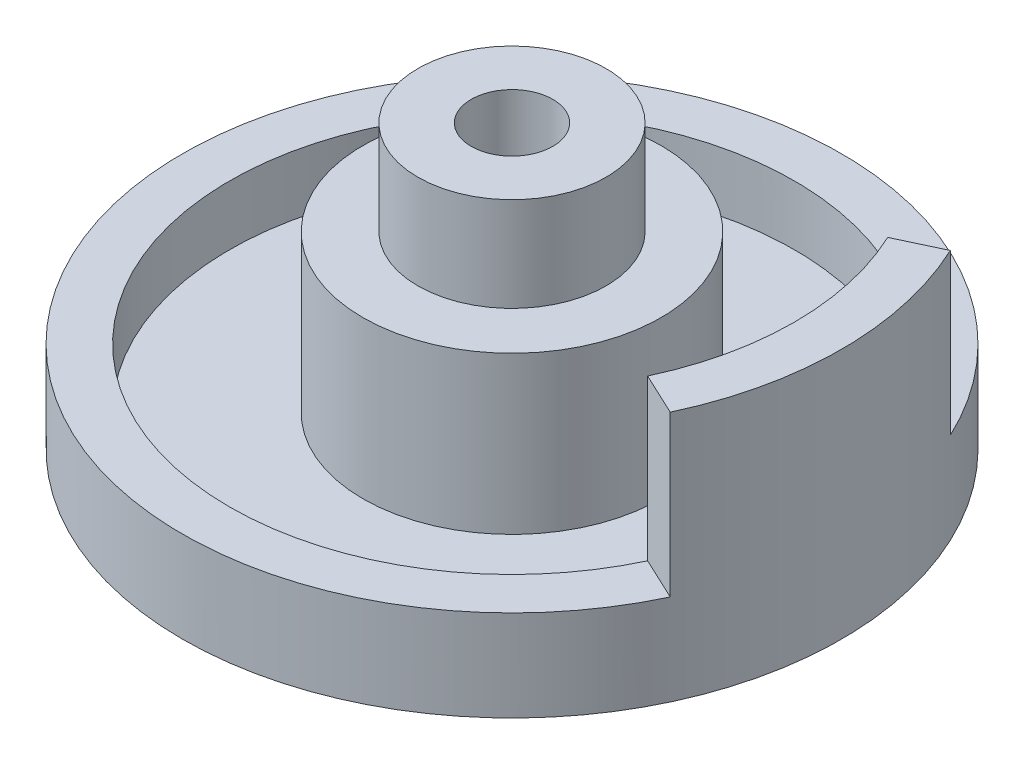
from build123d import *

# Parameters (mm, degrees)
SCHIZZO2_R                   = 10.5
ESTRUSIONE_ESTRUSIONE1_DEPTH = 8
TAGLIO_ESTRUSIONE1_START     = -2
TAGLIO_ESTRUSIONE1_DEPTH     = 2
TAGLIO_ESTRUSIONE2_START     = -3.1
SCHIZZO4_R                   = 4.75
TAGLIO_ESTRUSIONE2_DEPTH     = 3.1
TAGLIO_ESTRUSIONE4_START     = -1.9
SCHIZZO5_R                   = 9
SCHIZZO5_R_2                 = 4.75
TAGLIO_ESTRUSIONE4_DEPTH     = 1.9
SCHIZZO6_R                   = 3
ESTRUSIONE_ESTRUSIONE2_DEPTH = 3
TAGLIO_ESTRUSIONE5_DEPTH     = 2.48
FORO_PER_VITE_M2_1_D         = 2.6


with BuildPart() as part:
    # Schizzo2 → Estrusione-Estrusione1 (new body)
    with BuildSketch(Plane(origin=(0, 0, 0), x_dir=(1, 0, 0), z_dir=(0, 1, 0))):
        with Locations(Location((0, 0, 0), (0, 0, 270))):
            Circle(SCHIZZO2_R)
    extrude(amount=ESTRUSIONE_ESTRUSIONE1_DEPTH)

    # Schizzo3 → Taglio-Estrusione1 (cut)
    with BuildSketch(Plane(origin=(0, 8, 0), x_dir=(1, 0, 0), z_dir=(0, 1, 0)).offset(TAGLIO_ESTRUSIONE1_START)):
        with BuildLine():
            Line((8.146740146, 3.825), (9.50453017, 4.4625))
            ThreePointArc((9.50453017, 4.4625), (-10.5, 0), (9.50453017, -4.4625))
            Line((9.50453017, -4.4625), (8.146740146, -3.825))
            ThreePointArc((8.146740146, -3.825), (9, 0), (8.146740146, 3.825))
        make_face()
    extrude(amount=TAGLIO_ESTRUSIONE1_DEPTH, mode=Mode.SUBTRACT)

    # Schizzo4 → Taglio-Estrusione2 (cut)
    with BuildSketch(Plane(origin=(0, 6, 0), x_dir=(1, 0, 0), z_dir=(0, 1, 0)).offset(TAGLIO_ESTRUSIONE2_START)):
        with BuildLine():
            Line((8.146740146, 3.825), (9.50453017, 4.4625))
            ThreePointArc((9.50453017, 4.4625), (-10.5, 0), (9.50453017, -4.4625))
            Line((9.50453017, -4.4625), (8.146740146, -3.825))
            ThreePointArc((8.146740146, -3.825), (9, 0), (8.146740146, 3.825))
        make_face()
        with Locations(Location((0, 0, 0), (0, 0, 270))):
            Circle(SCHIZZO4_R, mode=Mode.SUBTRACT)
    extrude(amount=TAGLIO_ESTRUSIONE2_DEPTH, mode=Mode.SUBTRACT)

    # Schizzo5 → Taglio-Estrusione4 (cut)
    with BuildSketch(Plane(origin=(0, 2.9, 0), x_dir=(1, 0, 0), z_dir=(0, 1, 0)).offset(TAGLIO_ESTRUSIONE4_START)):
        with Locations(Location((0, 0, 0), (0, 0, 270))):
            Circle(SCHIZZO5_R)
        with Locations(Location((0, 0, 0), (0, 0, 270))):
            Circle(SCHIZZO5_R_2, mode=Mode.SUBTRACT)
    extrude(amount=TAGLIO_ESTRUSIONE4_DEPTH, mode=Mode.SUBTRACT)

    # Schizzo6 → Estrusione-Estrusione2 (add)
    with BuildSketch(Plane(origin=(0, 6, 0), x_dir=(1, 0, 0), z_dir=(0, 1, 0))):
        with Locations(Location((0, 0, 0), (0, 0, 270))):
            Circle(SCHIZZO6_R)
    extrude(amount=ESTRUSIONE_ESTRUSIONE2_DEPTH)

    # Schizzo7 → Taglio-Estrusione5 (cut)
    with BuildSketch(Plane.XZ):
        with BuildLine():
            Line((1.5, -2.598076211), (1.5, 2.598076211))
            ThreePointArc((1.5, 2.598076211), (-3, 0), (1.5, -2.598076211))
        make_face()
    extrude(amount=-TAGLIO_ESTRUSIONE5_DEPTH, mode=Mode.SUBTRACT)

    # Foro per Vite M2-1 (through all)
    with Locations(Plane(origin=(0, 9, 0), x_dir=(1, 0, 0), z_dir=(0, 1, 0))):
        with Locations((0, 0)):
            Hole(FORO_PER_VITE_M2_1_D / 2)


solid = part.part
